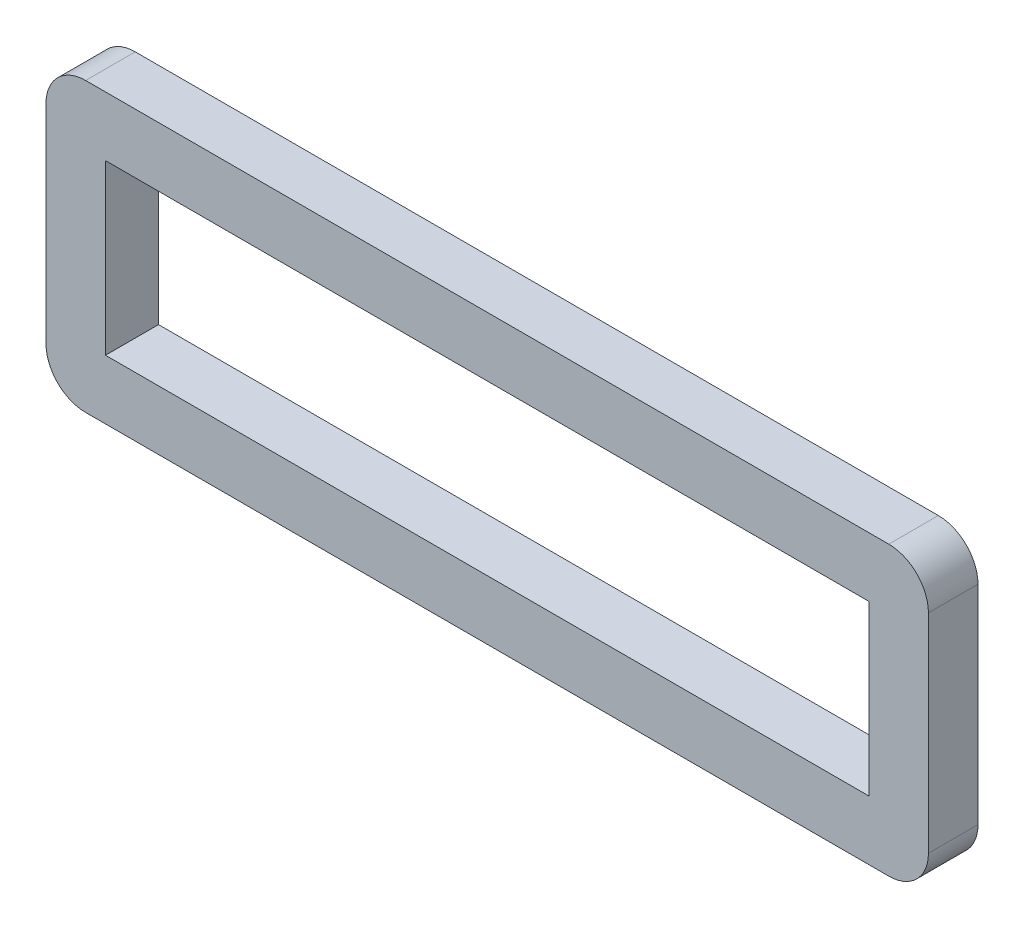
from build123d import *

# Parameters (mm, degrees)
SKETCH1_W           = 89
SKETCH1_H           = 29
SKETCH1_W_2         = 77
SKETCH1_H_2         = 17
BOSS_EXTRUDE1_DEPTH = 5
FILLET1_R           = 4
DRAFT1_ANGLE        = 4


with BuildPart() as part:
    # Sketch1 → Boss-Extrude1 (new body)
    with BuildSketch(Plane.XY):
        Rectangle(SKETCH1_W, SKETCH1_H)
        Rectangle(SKETCH1_W_2, SKETCH1_H_2, mode=Mode.SUBTRACT)
    extrude(amount=BOSS_EXTRUDE1_DEPTH)

    # Fillet1
    fillet1_edges = [part.edges().sort_by_distance(p)[0] for p in [
        (44.5, -14.5, 2.5),
        (-44.5, -14.5, 2.5),
        (-44.5, 14.5, 2.5),
        (44.5, 14.5, 2.5),
    ]]
    fillet(fillet1_edges, radius=FILLET1_R)

    # Draft1
    draft1_faces = [part.faces().sort_by_distance(p)[0] for p in [
        (38.5, 0, 2.5),
        (0, -8.5, 2.5),
        (-38.5, 0, 2.5),
        (0, 8.5, 2.5),
    ]]
    draft(draft1_faces, Plane.XY.offset(5), DRAFT1_ANGLE)


solid = part.part
